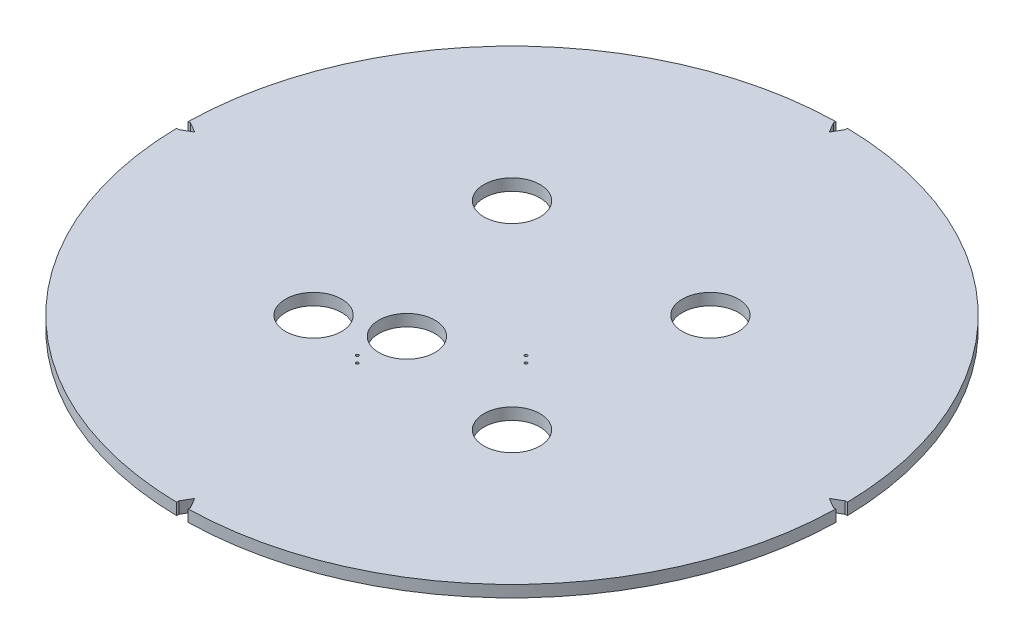
from build123d import *

# Parameters (mm, degrees)
SKETCH_1_R               = 705
EXTRUDE_1_DEPTH          = 25
CUT_EXTRUDE_1_REACH      = 999.334
PATTERN_CIRCULAR_1_COUNT = 4
CUT_EXTRUDE_2_REACH      = 999.177
SKETCH_8_R               = 60
SKETCH_11_R              = 60
CUT_EXTRUDE_3_DEPTH      = 100
SKETCH_12_R              = 3
CUT_EXTRUDE_4_DEPTH      = 998.177266087
SKETCH_13_R              = 3
CUT_EXTRUDE_5_DEPTH      = 30


with BuildPart() as part:
    # 草图1 → 凸台-拉伸1 (new body)
    with BuildSketch(Plane(origin=(0, 0, 0), x_dir=(1, 0, 0), z_dir=(0, 1, 0))):
        with Locations(Location((0, 0, 0), (0, 0, 270))):
            Circle(SKETCH_1_R)
    extrude(amount=EXTRUDE_1_DEPTH)

    # 草图2 → 切除-拉伸1 (cut, up to next)
    with BuildSketch(Plane(origin=(0, 25, 0), x_dir=(1, 0, 0), z_dir=(0, 1, 0)), mode=Mode.PRIVATE) as cut_extrude_1_sk1:
        with BuildLine():
            Line((-12.5, -699.994189271), (-12.5, -704.889175687))
            ThreePointArc((-12.5, -704.889175687), (0, -705), (12.5, -704.889175687))
            Line((12.5, -704.889175687), (12.5, -699.994189271))
            Line((12.5, -699.994189271), (0, -678.343554177))
            Line((0, -678.343554177), (-12.5, -699.994189271))
        make_face()
    cut_extrude_1_tool1 = extrude(cut_extrude_1_sk1.sketch, amount=-CUT_EXTRUDE_1_REACH, mode=Mode.PRIVATE) & part.part
    cut_extrude_1 = cut_extrude_1_tool1.solids().sort_by_distance((0, 25, 695.82939))[0]
    add(cut_extrude_1, mode=Mode.SUBTRACT)

    # 阵列(圆周)1: 切除-拉伸1 ×4 about axis
    pattern_circular_1_axis = Axis((0, 0, 0), (0, 1, 0))
    for i in range(1, PATTERN_CIRCULAR_1_COUNT):
        add(cut_extrude_1.rotate(pattern_circular_1_axis, i * 360 / PATTERN_CIRCULAR_1_COUNT), mode=Mode.SUBTRACT)

    # 草图8 → 切除-拉伸2 (cut, up to next)
    with BuildSketch(Plane(origin=(0, 25, 0), x_dir=(1, 0, 0), z_dir=(0, 1, 0)), mode=Mode.PRIVATE) as cut_extrude_2_sk1:
        with Locations(Location((212.132034356, -212.132034356, 0), (0, 0, 270))):
            Circle(SKETCH_8_R)
    cut_extrude_2_tool1 = extrude(cut_extrude_2_sk1.sketch, amount=-CUT_EXTRUDE_2_REACH, mode=Mode.PRIVATE) & part.part
    # 草图8 → 切除-拉伸2 (cut, up to next)
    with BuildSketch(Plane(origin=(0, 25, 0), x_dir=(1, 0, 0), z_dir=(0, 1, 0)), mode=Mode.PRIVATE) as cut_extrude_2_sk2:
        with Locations(Location((-212.132034356, -212.132034356, 0), (0, 0, 270))):
            Circle(SKETCH_8_R)
    cut_extrude_2_tool2 = extrude(cut_extrude_2_sk2.sketch, amount=-CUT_EXTRUDE_2_REACH, mode=Mode.PRIVATE) & part.part
    # 草图8 → 切除-拉伸2 (cut, up to next)
    with BuildSketch(Plane(origin=(0, 25, 0), x_dir=(1, 0, 0), z_dir=(0, 1, 0)), mode=Mode.PRIVATE) as cut_extrude_2_sk3:
        with Locations(Location((-212.132034356, 212.132034356, 0), (0, 0, 270))):
            Circle(SKETCH_8_R)
    cut_extrude_2_tool3 = extrude(cut_extrude_2_sk3.sketch, amount=-CUT_EXTRUDE_2_REACH, mode=Mode.PRIVATE) & part.part
    # 草图8 → 切除-拉伸2 (cut, up to next)
    with BuildSketch(Plane(origin=(0, 25, 0), x_dir=(1, 0, 0), z_dir=(0, 1, 0)), mode=Mode.PRIVATE) as cut_extrude_2_sk4:
        with Locations(Location((212.132034356, 212.132034356, 0), (0, 0, 270))):
            Circle(SKETCH_8_R)
    cut_extrude_2_tool4 = extrude(cut_extrude_2_sk4.sketch, amount=-CUT_EXTRUDE_2_REACH, mode=Mode.PRIVATE) & part.part
    add(cut_extrude_2_tool1.solids().sort_by_distance((212.132034, 25, 212.132034))[0], mode=Mode.SUBTRACT)
    add(cut_extrude_2_tool2.solids().sort_by_distance((-212.132034, 25, 212.132034))[0], mode=Mode.SUBTRACT)
    add(cut_extrude_2_tool3.solids().sort_by_distance((-212.132034, 25, -212.132034))[0], mode=Mode.SUBTRACT)
    add(cut_extrude_2_tool4.solids().sort_by_distance((212.132034, 25, -212.132034))[0], mode=Mode.SUBTRACT)

    # 草图11 → 切除-拉伸3 (cut)
    with BuildSketch(Plane(origin=(0, 25, 0), x_dir=(1, 0, 0), z_dir=(0, 1, 0))):
        with Locations(Location((-73.369984345, -151.389388343, 0), (0, 0, 270))):
            Circle(SKETCH_11_R)
    extrude(amount=-CUT_EXTRUDE_3_DEPTH, mode=Mode.SUBTRACT)

    # 草图12 → 切除-拉伸4 (cut, through all)
    with BuildSketch(Plane.XZ):
        with Locations(Location((103.406710952, 73.607642412, 0), (0, 0, 270))):
            Circle(SKETCH_12_R)
        with Locations(Location((89.264575328, 59.465506788, 0), (0, 0, 270))):
            Circle(SKETCH_12_R)
    extrude(amount=-CUT_EXTRUDE_4_DEPTH, mode=Mode.SUBTRACT)

    # 草图13 → 切除-拉伸5 (cut)
    with BuildSketch(Plane.XZ):
        with Locations(Location((-76.905518251, 253.919871615, 0), (0, 0, 270))):
            Circle(SKETCH_13_R)
        with Locations(Location((-91.047653874, 239.777735991, 0), (0, 0, 90))):
            Circle(SKETCH_13_R)
    extrude(amount=-CUT_EXTRUDE_5_DEPTH, mode=Mode.SUBTRACT)


solid = part.part
